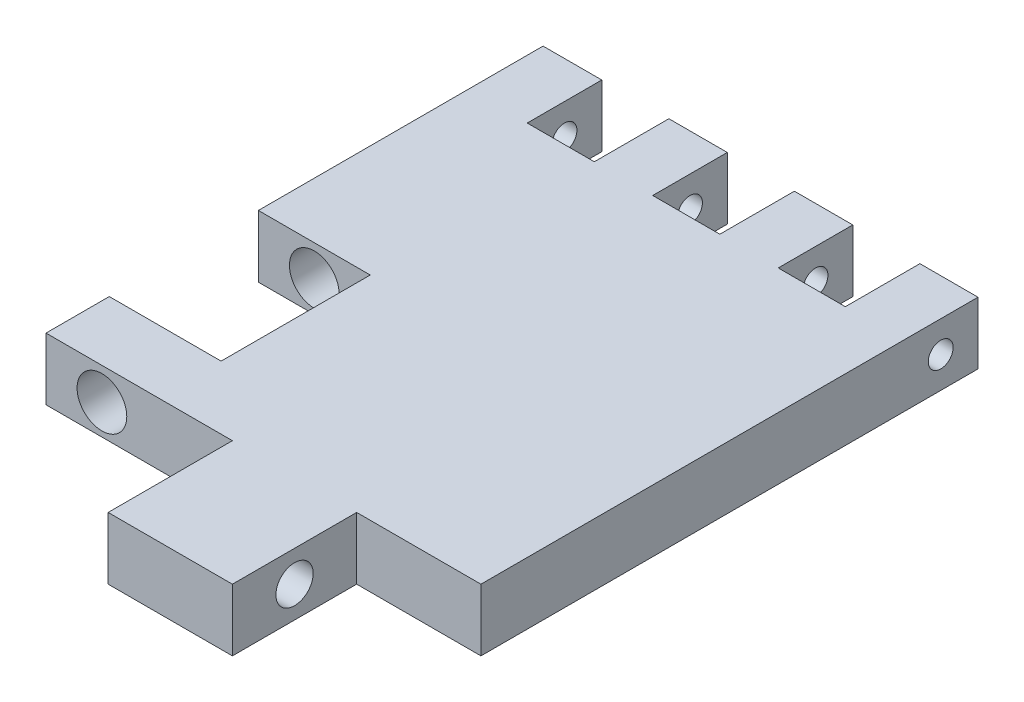
from build123d import *

# Parameters (mm, degrees)
BOSS_EXTRUDE1_DEPTH = 12.7
SKETCH3_W           = 13.716
SKETCH3_H           = 15.24
CUT_EXTRUDE1_DEPTH  = 12.7
SKETCH4_R           = 2.54
SKETCH4_R_2         = 3.81
CUT_EXTRUDE2_DEPTH  = 91.44
SKETCH7_W           = 22.86
SKETCH7_H           = 30.48
CUT_EXTRUDE10_DEPTH = 18.288
SKETCH8_R           = 5.08
CUT_EXTRUDE12_DEPTH = 54.61


with BuildPart() as part:
    # Sketch1 → Boss-Extrude1 (new body)
    with BuildSketch(Plane(origin=(0, 0, 0), x_dir=(1, 0, 0), z_dir=(0, 1, 0))):
        Polygon((63.5, 0), (88.9, 0), (88.9, 101.6), (0, 101.6), (0, 0), (38.1, 0), (38.1, -25.4), (63.5, -25.4), align=None)
    extrude(amount=BOSS_EXTRUDE1_DEPTH)

    # Sketch3 → Cut-Extrude1 (cut)
    with BuildSketch(Plane(origin=(0, 12.7, 0), x_dir=(1, 0, 0), z_dir=(0, 1, 0))):
        with Locations((18.858, 93.98)):
            Rectangle(SKETCH3_W, SKETCH3_H)
        with Locations((44.512, 93.98)):
            Rectangle(SKETCH3_W, SKETCH3_H)
        with Locations((70.166, 93.98)):
            Rectangle(SKETCH3_W, SKETCH3_H)
    extrude(amount=-CUT_EXTRUDE1_DEPTH, mode=Mode.SUBTRACT)

    # Sketch4 → Cut-Extrude2 (cut)
    with BuildSketch(Plane.ZY):
        with Locations((-93.98, 6.35)):
            Circle(SKETCH4_R)
        with Locations((12.7, 6.35)):
            Circle(SKETCH4_R_2)
    extrude(amount=-CUT_EXTRUDE2_DEPTH, mode=Mode.SUBTRACT)

    # Sketch7 → Cut-Extrude10 (cut)
    with BuildSketch(Plane.XZ):
        with Locations((11.43, -28.172925588)):
            Rectangle(SKETCH7_W, SKETCH7_H)
    extrude(amount=-CUT_EXTRUDE10_DEPTH, mode=Mode.SUBTRACT)

    # Sketch8 → Cut-Extrude12 (cut)
    with BuildSketch(Plane.XY):
        with Locations((11.43, 6.168740828)):
            Circle(SKETCH8_R)
    extrude(amount=-CUT_EXTRUDE12_DEPTH, mode=Mode.SUBTRACT)


solid = part.part
